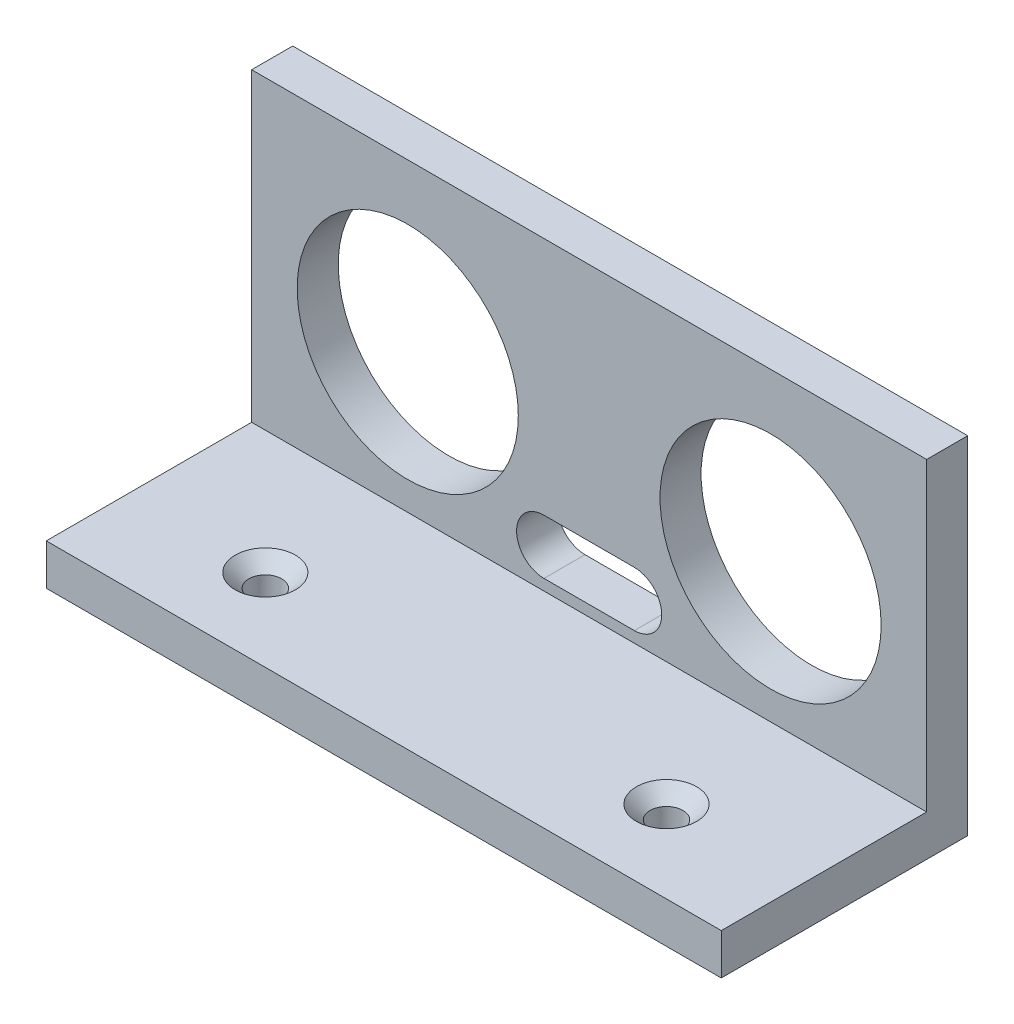
from build123d import *

# Parameters (mm, degrees)
SKETCH1_W                                           = 49.3
SKETCH1_H                                           = 25.3
BOSS_EXTRUDE1_DEPTH                                 = 1.5
SKETCH4_W                                           = 49.3
SKETCH4_H                                           = 3
BOSS_EXTRUDE2_DEPTH                                 = 15
CSK_FOR_M2_COUNTERSUNK_FLAT_HEAD_SCREW1_D           = 2.4
CSK_FOR_M2_COUNTERSUNK_FLAT_HEAD_SCREW1_CSINK_D     = 4.4
CSK_FOR_M2_COUNTERSUNK_FLAT_HEAD_SCREW1_CSINK_ANGLE = 90
CUT_EXTRUDE1_REACH                                  = 33.506
SKETCH8_R                                           = 8.075


with BuildPart() as part:
    # Sketch1 → Boss-Extrude1 (new, symmetric)
    with BuildSketch(Plane.XY):
        Rectangle(SKETCH1_W, SKETCH1_H)
    extrude(amount=BOSS_EXTRUDE1_DEPTH, both=True)

    # Sketch4 → Boss-Extrude2 (add)
    with BuildSketch(Plane.XY.offset(1.5)):
        with Locations((0, -11.15)):
            Rectangle(SKETCH4_W, SKETCH4_H)
    extrude(amount=BOSS_EXTRUDE2_DEPTH)

    # CSK for M2 Countersunk Flat Head Screw1 (through all)
    with Locations(Plane(origin=(0, -9.65, 0), x_dir=(1, 0, 0), z_dir=(0, 1, 0))):
        with Locations((-14.65, -10.5), (14.65, -10.5)):
            CounterSinkHole(CSK_FOR_M2_COUNTERSUNK_FLAT_HEAD_SCREW1_D / 2, CSK_FOR_M2_COUNTERSUNK_FLAT_HEAD_SCREW1_CSINK_D / 2, counter_sink_angle=CSK_FOR_M2_COUNTERSUNK_FLAT_HEAD_SCREW1_CSINK_ANGLE)

    # Sketch8 → Cut-Extrude1 (cut, up to next)
    with BuildSketch(Plane.XY.offset(1.5), mode=Mode.PRIVATE) as cut_extrude1_sk1:
        with Locations((-13.25, 0.5)):
            Circle(SKETCH8_R)
    cut_extrude1_tool1 = extrude(cut_extrude1_sk1.sketch, amount=-CUT_EXTRUDE1_REACH, mode=Mode.PRIVATE) & part.part
    # Sketch8 → Cut-Extrude1 (cut, up to next)
    with BuildSketch(Plane.XY.offset(1.5), mode=Mode.PRIVATE) as cut_extrude1_sk2:
        with Locations((13.25, 0.5)):
            Circle(SKETCH8_R)
    cut_extrude1_tool2 = extrude(cut_extrude1_sk2.sketch, amount=-CUT_EXTRUDE1_REACH, mode=Mode.PRIVATE) & part.part
    # Sketch8 → Cut-Extrude1 (cut, up to next)
    with BuildSketch(Plane.XY.offset(1.5), mode=Mode.PRIVATE) as cut_extrude1_sk3:
        with BuildLine():
            Line((-3.3, -4.85), (3.3, -4.85))
            ThreePointArc((3.3, -4.85), (5.3, -6.85), (3.3, -8.85))
            Line((3.3, -8.85), (-3.3, -8.85))
            ThreePointArc((-3.3, -8.85), (-5.3, -6.85), (-3.3, -4.85))
        make_face()
    cut_extrude1_tool3 = extrude(cut_extrude1_sk3.sketch, amount=-CUT_EXTRUDE1_REACH, mode=Mode.PRIVATE) & part.part
    add(cut_extrude1_tool1.solids().sort_by_distance((-13.25, 0.5, 1.5))[0], mode=Mode.SUBTRACT)
    add(cut_extrude1_tool2.solids().sort_by_distance((13.25, 0.5, 1.5))[0], mode=Mode.SUBTRACT)
    add(cut_extrude1_tool3.solids().sort_by_distance((0, -6.85, 1.5))[0], mode=Mode.SUBTRACT)


solid = part.part
